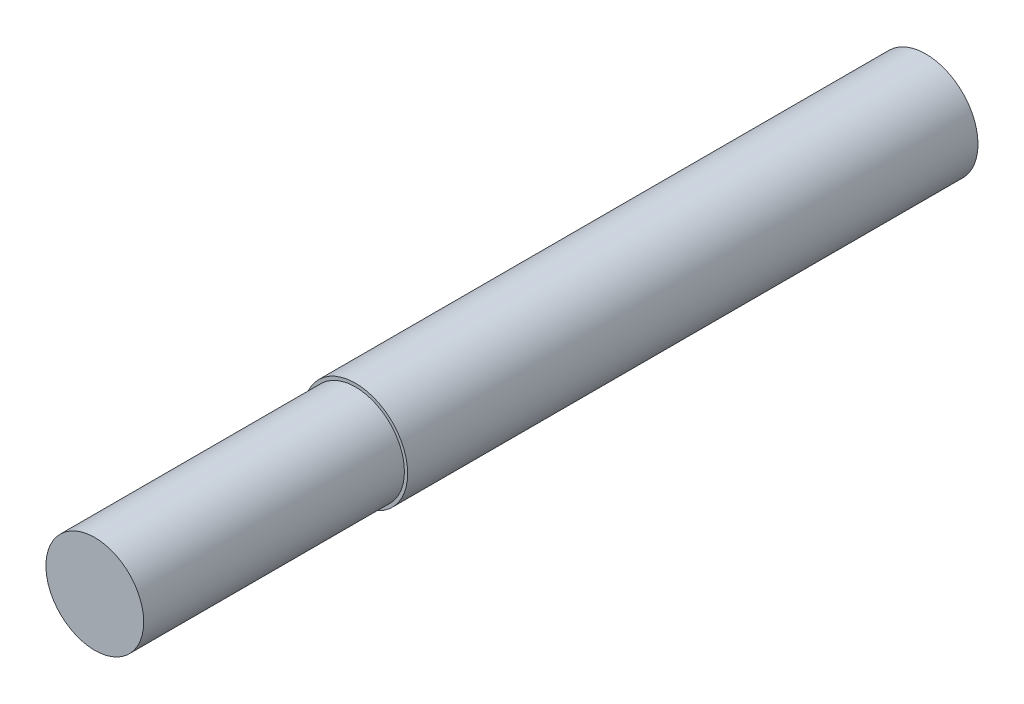
from build123d import *


with BuildPart() as part:
    # Эскиз1 → Повернуть1 (revolve)
    with BuildSketch(Plane(origin=(0, 0, 0), x_dir=(1, 0, 0), z_dir=(0, 1, 0)), mode=Mode.PRIVATE) as revolve_1_sk:
        Polygon((0, 0), (-1.5, 0), (-1.5, 8), (-1.6, 8), (-1.6, 25.5), (-0.75, 25.5), (-0.75, 17.5), (0, 17.5), align=None)
    revolve(revolve_1_sk.sketch.rotate(Axis((0, 0, 0), (0, 0, -1)), 180), axis=Axis((0, 0, 0), (0, 0, -1)))


solid = part.part
